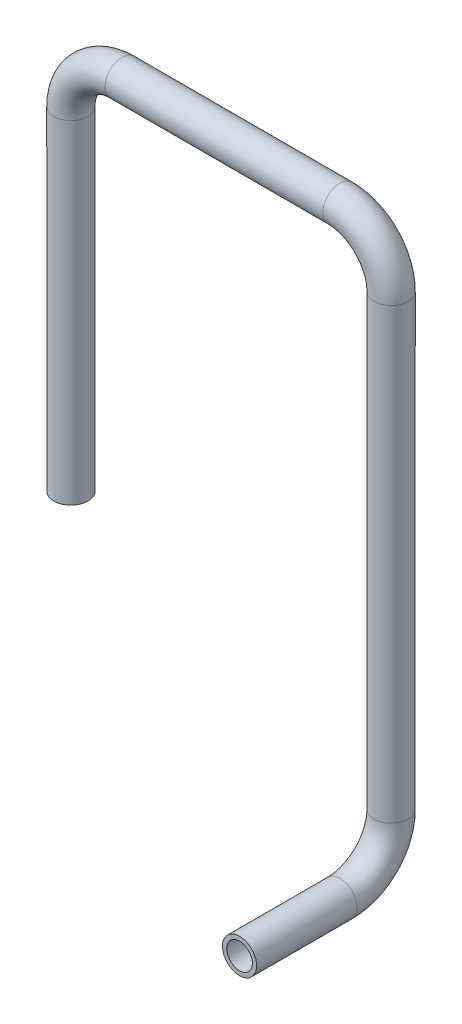
from build123d import *

# Parameters (mm, degrees)
TUBE_PROFILE_R   = 4
TUBE_PROFILE_R_2 = 3


with BuildPart() as part:
    # Tube: sweep along a curve in space
    with BuildLine() as tube_path:
        Line((180, 21, -89.5), (180, 21, -113))
        ThreePointArc((180, 33, -125), (180, 24.514718626, -121.485281374), (180, 21, -113))
        Line((180, 33, -125), (180, 138, -125))
        ThreePointArc((168, 150, -125), (176.485281374, 146.485281374, -125), (180, 138, -125))
        Line((168, 150, -125), (117, 150, -125))
        ThreePointArc((105, 138, -125), (108.514718626, 146.485281374, -125), (117, 150, -125))
        Line((105, 138, -125), (105, 60, -125))
    # Tube profile (on start of the path) → Tube (sweep)
    with BuildSketch(Plane(origin=(180, 21, -89.5), x_dir=(-1, 0, 0), z_dir=(0, 0, -1))):
        Circle(TUBE_PROFILE_R)
        Circle(TUBE_PROFILE_R_2, mode=Mode.SUBTRACT)
    sweep(path=tube_path.line)


solid = part.part
